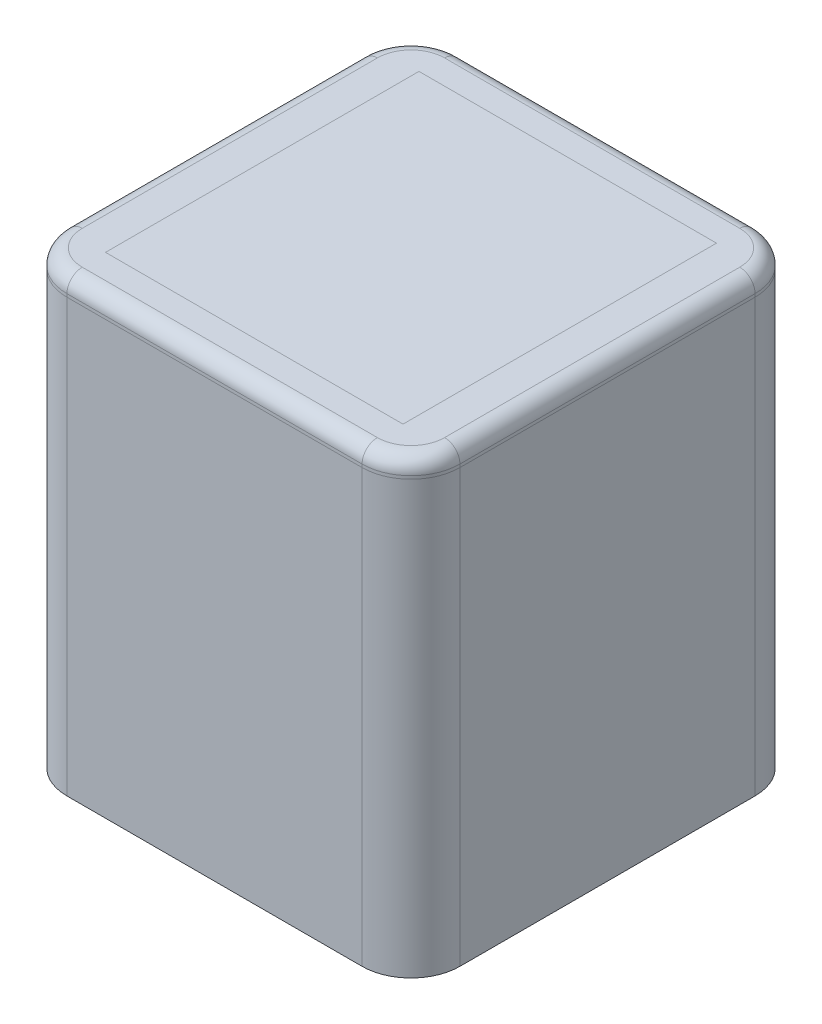
from build123d import *

# Parameters (mm, degrees)
SKETCH1_W           = 25.7
SKETCH1_H           = 25.7
SKETCH1_W_2         = 19.457250824
SKETCH1_H_2         = 20.5
BOSS_EXTRUDE1_DEPTH = 28.25
SKETCH1_5_W         = 19.457250824
SKETCH1_5_H         = 20.5
BOSS_EXTRUDE4_DEPTH = 22.86
BOSS_EXTRUDE2_START = 28.25
SKETCH1_3_W         = 19.457250824
SKETCH1_3_H         = 20.5
BOSS_EXTRUDE2_DEPTH = 1.2
BOSS_EXTRUDE3_START = 28.25
SKETCH1_4_W         = 25.7
SKETCH1_4_H         = 25.7
SKETCH1_4_W_2       = 19.457250824
SKETCH1_4_H_2       = 20.5
BOSS_EXTRUDE3_DEPTH = 1.2
FILLET1_R           = 3.19999995
FILLET2_R           = 3.19999995
FILLET3_R           = 1


with BuildPart() as part:
    # Sketch1 → Boss-Extrude1 (new body)
    with BuildSketch(Plane(origin=(0, 0, 0), x_dir=(1, 0, 0), z_dir=(0, 1, 0))):
        Rectangle(SKETCH1_W, SKETCH1_H)
        Rectangle(SKETCH1_W_2, SKETCH1_H_2, mode=Mode.SUBTRACT)
    extrude(amount=BOSS_EXTRUDE1_DEPTH)

    # Sketch1<5> → Boss-Extrude4 (add)
    with BuildSketch(Plane(origin=(0, 0, 0), x_dir=(1, 0, 0), z_dir=(0, 1, 0))):
        Rectangle(SKETCH1_5_W, SKETCH1_5_H)
    extrude(amount=BOSS_EXTRUDE4_DEPTH)

    # Fillet1
    fillet1_edges = [part.edges().sort_by_distance(p)[0] for p in [
        (-12.85, 14.125, 12.85),
        (-12.85, 14.125, -12.85),
        (12.85, 14.125, -12.85),
        (12.85, 14.125, 12.85),
    ]]
    fillet(fillet1_edges, radius=FILLET1_R)


with BuildPart() as body_2:
    # Sketch1<3> → Boss-Extrude2 (new body)
    with BuildSketch(Plane(origin=(0, 0, 0), x_dir=(1, 0, 0), z_dir=(0, 1, 0)).offset(BOSS_EXTRUDE2_START)):
        Rectangle(SKETCH1_3_W, SKETCH1_3_H)
    extrude(amount=BOSS_EXTRUDE2_DEPTH)


with BuildPart() as body_3:
    # Sketch1<4> → Boss-Extrude3 (new body)
    with BuildSketch(Plane(origin=(0, 0, 0), x_dir=(1, 0, 0), z_dir=(0, 1, 0)).offset(BOSS_EXTRUDE3_START)):
        Rectangle(SKETCH1_4_W, SKETCH1_4_H)
        Rectangle(SKETCH1_4_W_2, SKETCH1_4_H_2, mode=Mode.SUBTRACT)
    extrude(amount=BOSS_EXTRUDE3_DEPTH)

    # Fillet2
    fillet2_edges = [body_3.edges().sort_by_distance(p)[0] for p in [
        (-12.85, 28.85, 12.85),
        (12.85, 28.85, 12.85),
        (12.85, 28.85, -12.85),
        (-12.85, 28.85, -12.85),
    ]]
    fillet(fillet2_edges, radius=FILLET2_R)

    # Fillet3
    fillet3_edges = [body_3.edges().sort_by_distance(p)[0] for p in [
        (-12.85, 29.45, 0),
        (0, 29.45, -12.85),
        (0, 29.45, 12.85),
        (12.85, 29.45, 0),
        (-11.912741714, 29.45, 11.912741714),
        (11.912741714, 29.45, 11.912741714),
        (11.912741714, 29.45, -11.912741714),
        (-11.912741714, 29.45, -11.912741714),
    ]]
    fillet(fillet3_edges, radius=FILLET3_R)


solid = Compound([part.part, body_2.part, body_3.part])
